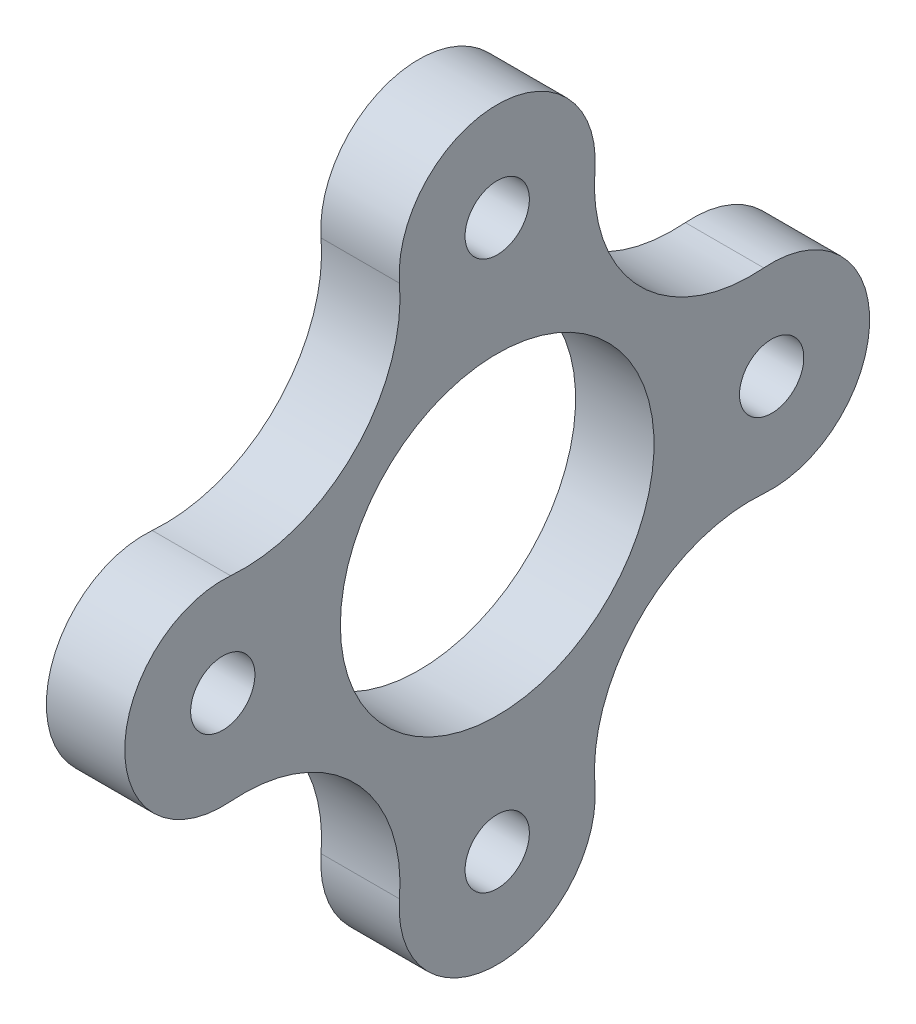
from build123d import *

# Parameters (mm, degrees)
SKETCH1_R           = 12.7
SKETCH1_R_2         = 2.6035
BOSS_EXTRUDE1_DEPTH = 6.35


with BuildPart() as part:
    # Sketch1 → Boss-Extrude1 (new body)
    with BuildSketch(Plane.ZY.offset(-33.3375)):
        with BuildLine():
            ThreePointArc((26.955926991, 186.931527045), (24.401493508, 181.09830314), (18.382320409, 179.019556705))
            ThreePointArc((18.382320409, 179.019556705), (8.384293755, 175.340660282), (4.705397332, 165.342633628))
            ThreePointArc((4.705397332, 165.342633628), (2.626650896, 159.323460528), (-3.206573009, 156.769027045))
            ThreePointArc((-3.206573009, 156.769027045), (-9.039796914, 159.323460528), (-11.118543349, 165.342633628))
            ThreePointArc((-11.118543349, 165.342633628), (-14.797439772, 175.340660282), (-24.795466426, 179.019556705))
            ThreePointArc((-24.795466426, 179.019556705), (-30.814639526, 181.09830314), (-33.369073009, 186.931527045))
            ThreePointArc((-33.369073009, 186.931527045), (-30.814639526, 192.76475095), (-24.795466426, 194.843497386))
            ThreePointArc((-24.795466426, 194.843497386), (-14.797439772, 198.522393809), (-11.118543349, 208.520420462))
            ThreePointArc((-11.118543349, 208.520420462), (-9.039796914, 214.539593562), (-3.206573009, 217.094027045))
            ThreePointArc((-3.206573009, 217.094027045), (2.626650896, 214.539593562), (4.705397332, 208.520420462))
            ThreePointArc((4.705397332, 208.520420462), (8.384293755, 198.522393809), (18.382320409, 194.843497386))
            ThreePointArc((18.382320409, 194.843497386), (24.401493508, 192.76475095), (26.955926991, 186.931527045))
        make_face()
        with Locations((-3.206573009, 186.931527045)):
            Circle(SKETCH1_R, mode=Mode.SUBTRACT)
        with Locations((19.018426991, 186.931527045)):
            Circle(SKETCH1_R_2, mode=Mode.SUBTRACT)
        with Locations((-3.206573009, 164.706527045)):
            Circle(SKETCH1_R_2, mode=Mode.SUBTRACT)
        with Locations((-25.431573009, 186.931527045)):
            Circle(SKETCH1_R_2, mode=Mode.SUBTRACT)
        with Locations((-3.206573009, 209.156527045)):
            Circle(SKETCH1_R_2, mode=Mode.SUBTRACT)
    extrude(amount=BOSS_EXTRUDE1_DEPTH)


solid = part.part
